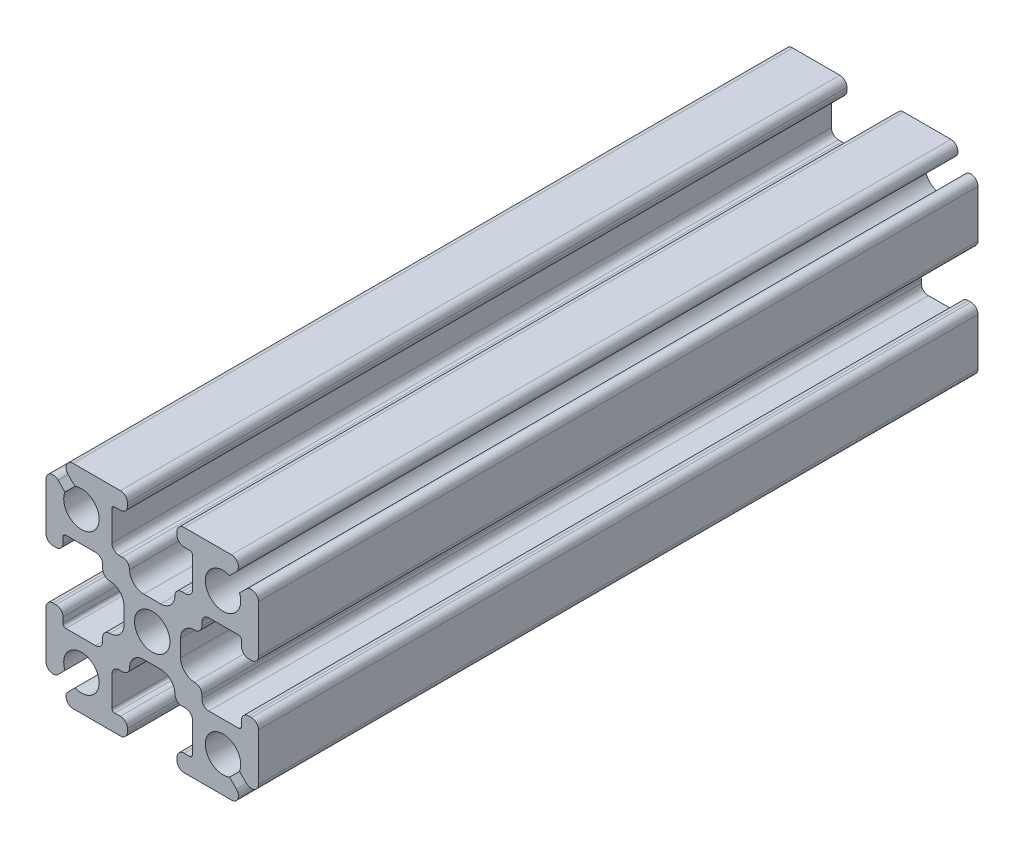
from build123d import *

# Parameters (mm, degrees)
SKETCH1_R           = 1.25
BOSS_EXTRUDE1_DEPTH = 50.8


with BuildPart() as part:
    # Sketch1 → Boss-Extrude1 (new body)
    with BuildSketch(Plane.XY):
        with BuildLine():
            Line((6.646446609, 5.939339828), (6.163645978, 5.456539197))
            ThreePointArc((6.163645978, 5.456539197), (4.116116524, 4.116116524), (5.456539197, 6.163645978))
            Line((5.456539197, 6.163645978), (5.939339828, 6.646446609))
            ThreePointArc((5.939339828, 6.646446609), (6.047726204, 7.191341716), (5.585786438, 7.5))
            Line((5.585786438, 7.5), (2.25, 7.5))
            ThreePointArc((2.25, 7.5), (1.896446609, 7.353553391), (1.75, 7))
            Line((1.75, 7), (1.75, 6.8))
            ThreePointArc((1.75, 6.8), (1.896446609, 6.446446609), (2.25, 6.3))
            Line((2.25, 6.3), (2.65, 6.3))
            ThreePointArc((2.65, 6.3), (2.791421356, 6.241421356), (2.85, 6.1))
            Line((2.85, 6.1), (2.85, 4))
            ThreePointArc((2.85, 4), (2.703553391, 3.646446609), (2.35, 3.5))
            Line((2.35, 3.5), (2.1, 3.5))
            ThreePointArc((2.1, 3.5), (1.746446609, 3.353553391), (1.6, 3))
            ThreePointArc((1.6, 3), (1.307106781, 2.292893219), (0.6, 2))
            Line((0.6, 2), (-0.6, 2))
            ThreePointArc((-0.6, 2), (-1.307106781, 2.292893219), (-1.6, 3))
            ThreePointArc((-1.6, 3), (-1.746446609, 3.353553391), (-2.1, 3.5))
            Line((-2.1, 3.5), (-2.35, 3.5))
            ThreePointArc((-2.35, 3.5), (-2.703553391, 3.646446609), (-2.85, 4))
            Line((-2.85, 4), (-2.85, 6.1))
            ThreePointArc((-2.85, 6.1), (-2.791421356, 6.241421356), (-2.65, 6.3))
            Line((-2.65, 6.3), (-2.25, 6.3))
            ThreePointArc((-2.25, 6.3), (-1.896446609, 6.446446609), (-1.75, 6.8))
            Line((-1.75, 6.8), (-1.75, 7))
            ThreePointArc((-1.75, 7), (-1.896446609, 7.353553391), (-2.25, 7.5))
            Line((-2.25, 7.5), (-5.585786438, 7.5))
            ThreePointArc((-5.585786438, 7.5), (-6.047726204, 7.191341716), (-5.939339828, 6.646446609))
            Line((-5.939339828, 6.646446609), (-5.456539197, 6.163645978))
            ThreePointArc((-5.456539197, 6.163645978), (-4.116116524, 4.116116524), (-6.163645978, 5.456539197))
            Line((-6.163645978, 5.456539197), (-6.646446609, 5.939339828))
            ThreePointArc((-6.646446609, 5.939339828), (-7.191341716, 6.047726204), (-7.5, 5.585786438))
            Line((-7.5, 5.585786438), (-7.5, 2.25))
            ThreePointArc((-7.5, 2.25), (-7.353553391, 1.896446609), (-7, 1.75))
            Line((-7, 1.75), (-6.8, 1.75))
            ThreePointArc((-6.8, 1.75), (-6.446446609, 1.896446609), (-6.3, 2.25))
            Line((-6.3, 2.25), (-6.3, 2.65))
            ThreePointArc((-6.3, 2.65), (-6.241421356, 2.791421356), (-6.1, 2.85))
            Line((-6.1, 2.85), (-4, 2.85))
            ThreePointArc((-4, 2.85), (-3.646446609, 2.703553391), (-3.5, 2.35))
            Line((-3.5, 2.35), (-3.5, 2.1))
            ThreePointArc((-3.5, 2.1), (-3.353553391, 1.746446609), (-3, 1.6))
            ThreePointArc((-3, 1.6), (-2.292893219, 1.307106781), (-2, 0.6))
            Line((-2, 0.6), (-2, -0.6))
            ThreePointArc((-2, -0.6), (-2.292893219, -1.307106781), (-3, -1.6))
            ThreePointArc((-3, -1.6), (-3.353553391, -1.746446609), (-3.5, -2.1))
            Line((-3.5, -2.1), (-3.5, -2.35))
            ThreePointArc((-3.5, -2.35), (-3.646446609, -2.703553391), (-4, -2.85))
            Line((-4, -2.85), (-6.1, -2.85))
            ThreePointArc((-6.1, -2.85), (-6.241421356, -2.791421356), (-6.3, -2.65))
            Line((-6.3, -2.65), (-6.3, -2.25))
            ThreePointArc((-6.3, -2.25), (-6.446446609, -1.896446609), (-6.8, -1.75))
            Line((-6.8, -1.75), (-7, -1.75))
            ThreePointArc((-7, -1.75), (-7.353553391, -1.896446609), (-7.5, -2.25))
            Line((-7.5, -2.25), (-7.5, -5.585786438))
            ThreePointArc((-7.5, -5.585786438), (-7.191341716, -6.047726204), (-6.646446609, -5.939339828))
            Line((-6.646446609, -5.939339828), (-6.163645978, -5.456539197))
            ThreePointArc((-6.163645978, -5.456539197), (-4.116116524, -4.116116524), (-5.456539197, -6.163645978))
            Line((-5.456539197, -6.163645978), (-5.939339828, -6.646446609))
            ThreePointArc((-5.939339828, -6.646446609), (-6.047726204, -7.191341716), (-5.585786438, -7.5))
            Line((-5.585786438, -7.5), (-2.25, -7.5))
            ThreePointArc((-2.25, -7.5), (-1.896446609, -7.353553391), (-1.75, -7))
            Line((-1.75, -7), (-1.75, -6.8))
            ThreePointArc((-1.75, -6.8), (-1.896446609, -6.446446609), (-2.25, -6.3))
            Line((-2.25, -6.3), (-2.65, -6.3))
            ThreePointArc((-2.65, -6.3), (-2.791421356, -6.241421356), (-2.85, -6.1))
            Line((-2.85, -6.1), (-2.85, -4))
            ThreePointArc((-2.85, -4), (-2.703553391, -3.646446609), (-2.35, -3.5))
            Line((-2.35, -3.5), (-2.1, -3.5))
            ThreePointArc((-2.1, -3.5), (-1.746446609, -3.353553391), (-1.6, -3))
            ThreePointArc((-1.6, -3), (-1.307106781, -2.292893219), (-0.6, -2))
            Line((-0.6, -2), (0.6, -2))
            ThreePointArc((0.6, -2), (1.307106781, -2.292893219), (1.6, -3))
            ThreePointArc((1.6, -3), (1.746446609, -3.353553391), (2.1, -3.5))
            Line((2.1, -3.5), (2.35, -3.5))
            ThreePointArc((2.35, -3.5), (2.703553391, -3.646446609), (2.85, -4))
            Line((2.85, -4), (2.85, -6.1))
            ThreePointArc((2.85, -6.1), (2.791421356, -6.241421356), (2.65, -6.3))
            Line((2.65, -6.3), (2.25, -6.3))
            ThreePointArc((2.25, -6.3), (1.896446609, -6.446446609), (1.75, -6.8))
            Line((1.75, -6.8), (1.75, -7))
            ThreePointArc((1.75, -7), (1.896446609, -7.353553391), (2.25, -7.5))
            Line((2.25, -7.5), (5.585786438, -7.5))
            ThreePointArc((5.585786438, -7.5), (6.047726204, -7.191341716), (5.939339828, -6.646446609))
            Line((5.939339828, -6.646446609), (5.456539197, -6.163645978))
            ThreePointArc((5.456539197, -6.163645978), (4.116116524, -4.116116524), (6.163645978, -5.456539197))
            Line((6.163645978, -5.456539197), (6.646446609, -5.939339828))
            ThreePointArc((6.646446609, -5.939339828), (7.191341716, -6.047726204), (7.5, -5.585786438))
            Line((7.5, -5.585786438), (7.5, -2.25))
            ThreePointArc((7.5, -2.25), (7.353553391, -1.896446609), (7, -1.75))
            Line((7, -1.75), (6.8, -1.75))
            ThreePointArc((6.8, -1.75), (6.446446609, -1.896446609), (6.3, -2.25))
            Line((6.3, -2.25), (6.3, -2.65))
            ThreePointArc((6.3, -2.65), (6.241421356, -2.791421356), (6.1, -2.85))
            Line((6.1, -2.85), (4, -2.85))
            ThreePointArc((4, -2.85), (3.646446609, -2.703553391), (3.5, -2.35))
            Line((3.5, -2.35), (3.5, -2.1))
            ThreePointArc((3.5, -2.1), (3.353553391, -1.746446609), (3, -1.6))
            ThreePointArc((3, -1.6), (2.292893219, -1.307106781), (2, -0.6))
            Line((2, -0.6), (2, 0.6))
            ThreePointArc((2, 0.6), (2.292893219, 1.307106781), (3, 1.6))
            ThreePointArc((3, 1.6), (3.353553391, 1.746446609), (3.5, 2.1))
            Line((3.5, 2.1), (3.5, 2.35))
            ThreePointArc((3.5, 2.35), (3.646446609, 2.703553391), (4, 2.85))
            Line((4, 2.85), (6.1, 2.85))
            ThreePointArc((6.1, 2.85), (6.241421356, 2.791421356), (6.3, 2.65))
            Line((6.3, 2.65), (6.3, 2.25))
            ThreePointArc((6.3, 2.25), (6.446446609, 1.896446609), (6.8, 1.75))
            Line((6.8, 1.75), (7, 1.75))
            ThreePointArc((7, 1.75), (7.353553391, 1.896446609), (7.5, 2.25))
            Line((7.5, 2.25), (7.5, 5.585786438))
            ThreePointArc((7.5, 5.585786438), (7.191341716, 6.047726204), (6.646446609, 5.939339828))
        make_face()
        with Locations(Location((0, 0, 0), (0, 0, 180))):
            Circle(SKETCH1_R, mode=Mode.SUBTRACT)
    extrude(amount=BOSS_EXTRUDE1_DEPTH)


solid = part.part
